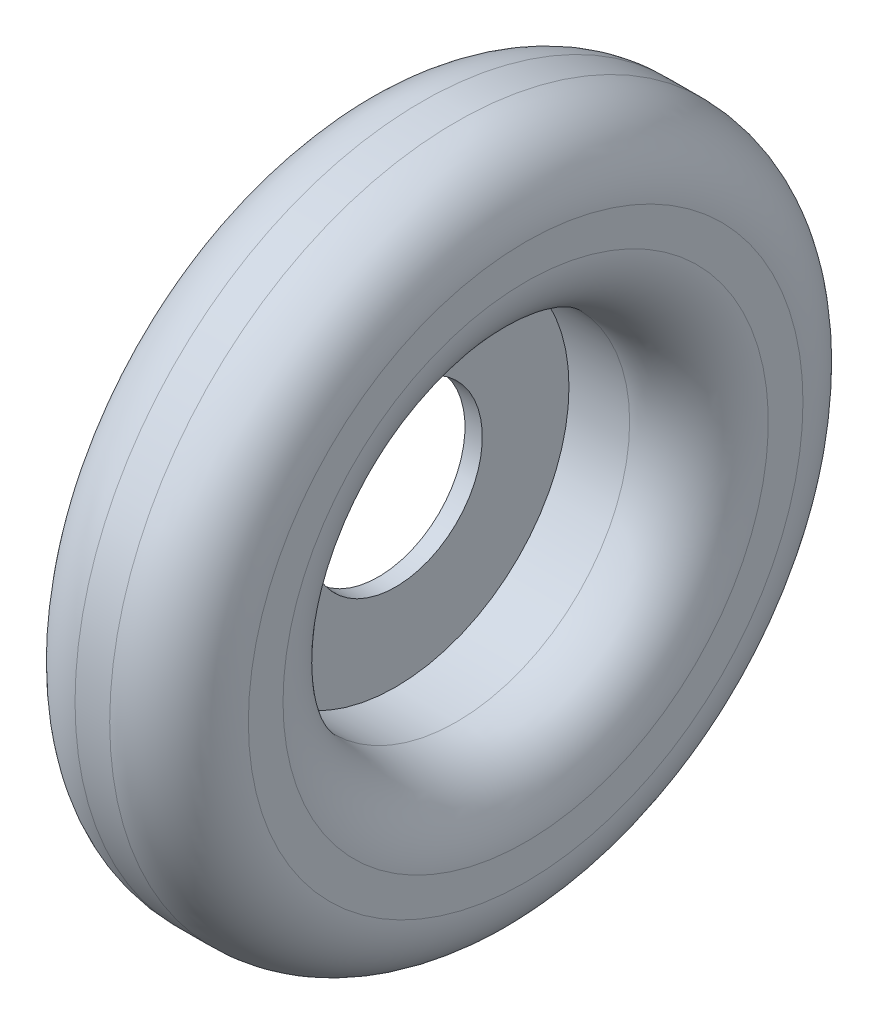
from build123d import *


with BuildPart() as part:
    # Sketch2 → Revolve1 (revolve)
    with BuildSketch(Plane.XY, mode=Mode.PRIVATE) as revolve1_sk:
        with BuildLine():
            Line((0, 50), (0, 100))
            ThreePointArc((0, 100), (-10.606601718, 104.393398282), (-15, 115))
            Line((-15, 115), (-15, 160))
            ThreePointArc((-15, 160), (-3.284271247, 188.284271247), (25, 200))
            Line((25, 200), (45, 200))
            ThreePointArc((45, 200), (73.284271247, 188.284271247), (85, 160))
            Line((85, 160), (85, 140))
            ThreePointArc((85, 140), (73.284271247, 111.715728753), (45, 100))
            Line((45, 100), (10, 100))
            Line((10, 100), (10, 50))
            Line((10, 50), (0, 50))
        make_face()
        with BuildLine():
            Line((25, 195), (45, 195))
            ThreePointArc((45, 195), (69.748737342, 184.748737342), (80, 160))
            Line((80, 160), (80, 140))
            ThreePointArc((80, 140), (69.748737342, 115.251262658), (45, 105))
            Line((45, 105), (0, 105))
            ThreePointArc((0, 105), (-7.071067812, 107.928932188), (-10, 115))
            Line((-10, 115), (-10, 160))
            ThreePointArc((-10, 160), (0.251262658, 184.748737342), (25, 195))
        make_face(mode=Mode.SUBTRACT)
    revolve(revolve1_sk.sketch.rotate(Axis((0, 0, 0), (1, 0, 0)), 90), axis=Axis((0, 0, 0), (1, 0, 0)))


solid = part.part
